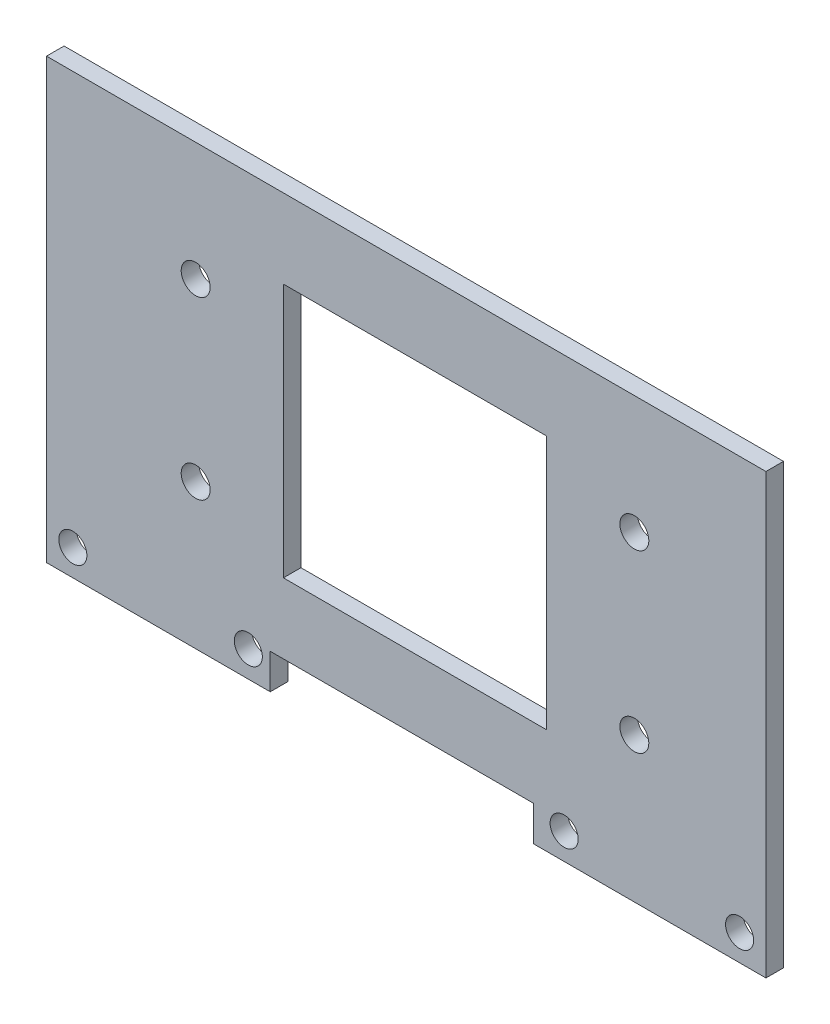
from build123d import *

# Parameters (mm, degrees)
SKETCH_1_W          = 80
SKETCH_1_H          = 50
SKETCH_1_W_2        = 30
SKETCH_1_H_2        = 29
EXTRUDE_1_DEPTH     = 2
SKETCH_5_W          = 2
SKETCH_5_H          = 50
EXTRUDE_2_DEPTH     = 2
SKETCH_2_W          = 30
SKETCH_2_H          = 4
CUT_EXTRUDE_1_DEPTH = 49.918299235
SKETCH_3_R          = 1.6
CUT_EXTRUDE_2_DEPTH = 49.918299235
SKETCH_6_W          = 1.5
SKETCH_6_H          = 4
CUT_EXTRUDE_4_DEPTH = 49.918299235
SKETCH_7_W          = 1.5
SKETCH_7_H          = 4
EXTRUDE_3_DEPTH     = 2
SKETCH_8_R          = 1.65
CUT_EXTRUDE_5_DEPTH = 49.918299235


with BuildPart() as part:
    # 草图1 → 凸台-拉伸1 (new body)
    with BuildSketch(Plane.XY):
        Rectangle(SKETCH_1_W, SKETCH_1_H)
        with Locations((0, 1.5)):
            Rectangle(SKETCH_1_W_2, SKETCH_1_H_2, mode=Mode.SUBTRACT)
    extrude(amount=EXTRUDE_1_DEPTH)

    # 草图5 → 凸台-拉伸2 (add)
    with BuildSketch(Plane.XY.offset(2)):
        with Locations((-41, 0)):
            Rectangle(SKETCH_5_W, SKETCH_5_H)
    extrude(amount=-EXTRUDE_2_DEPTH)

    # 草图2 → 切除-拉伸1 (cut, through all)
    with BuildSketch(Plane.XY.offset(2)):
        with Locations((0, -23)):
            Rectangle(SKETCH_2_W, SKETCH_2_H)
    extrude(amount=-CUT_EXTRUDE_1_DEPTH, mode=Mode.SUBTRACT)

    # 草图3 → 切除-拉伸2 (cut, through all)
    with BuildSketch(Plane.XY.offset(2)):
        with Locations((-39, -22)):
            Circle(SKETCH_3_R)
        with Locations((-19, -22)):
            Circle(SKETCH_3_R)
        with Locations(Location((17, -22, 0), (0, 0, 180))):
            Circle(SKETCH_3_R)
        with Locations(Location((37, -22, 0), (0, 0, 180))):
            Circle(SKETCH_3_R)
    extrude(amount=-CUT_EXTRUDE_2_DEPTH, mode=Mode.SUBTRACT)

    # 草图6 → 切除-拉伸4 (cut, through all)
    with BuildSketch(Plane.XY.offset(2)):
        with Locations((-15.75, -23)):
            Rectangle(SKETCH_6_W, SKETCH_6_H)
    extrude(amount=-CUT_EXTRUDE_4_DEPTH, mode=Mode.SUBTRACT)

    # 草图7 → 凸台-拉伸3 (add)
    with BuildSketch(Plane.XY.offset(2)):
        with Locations((14.25, -23)):
            Rectangle(SKETCH_7_W, SKETCH_7_H)
    extrude(amount=-EXTRUDE_3_DEPTH)

    # 草图8 → 切除-拉伸5 (cut, through all)
    with BuildSketch(Plane.XY.offset(2)):
        with Locations((-25, 11.5)):
            Circle(SKETCH_8_R)
        with Locations(Location((25, 11.5, 0), (0, 0, 180))):
            Circle(SKETCH_8_R)
        with Locations(Location((-25, -8.5, 0), (0, 0, 180))):
            Circle(SKETCH_8_R)
        with Locations((25, -8.5)):
            Circle(SKETCH_8_R)
    extrude(amount=-CUT_EXTRUDE_5_DEPTH, mode=Mode.SUBTRACT)


solid = part.part
